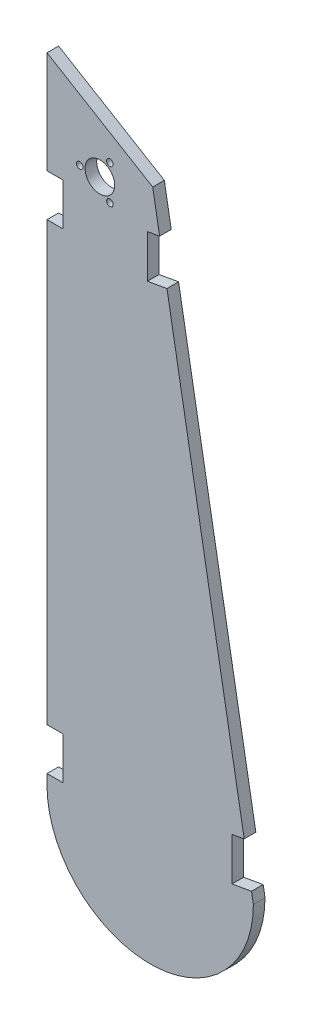
from build123d import *

# Parameters (mm, degrees)
EXTRUDE_1_DEPTH          = 5.5
SKETCH_5_R               = 7
CUT_EXTRUDE_1_DEPTH      = 316.527538037
SKETCH_6_R               = 1.55
CUT_EXTRUDE_2_DEPTH      = 316.527538037
PATTERN_CIRCULAR_1_COUNT = 3
SKETCH_7_W               = 7.5
SKETCH_7_H               = 20
CUT_EXTRUDE_3_DEPTH      = 316.527538037
SKETCH_8_W               = 7.5
SKETCH_8_H               = 20
CUT_EXTRUDE_4_DEPTH      = 316.6542844
CUT_EXTRUDE_5_DEPTH      = 316.6542844
CUT_EXTRUDE_6_DEPTH      = 316.6542844


with BuildPart() as part:
    # ｽｹｯﾁ1 → ﾎﾞｽ - 押し出し1 (new body)
    with BuildSketch(Plane.XY):
        with BuildLine():
            Line((0, 0), (0, 300))
            Line((0, 300), (50, 270))
            Line((50, 270), (97.608284791, 0))
            ThreePointArc((97.608284791, 0), (48.804142396, -48.804142396), (0, 0))
        make_face()
    extrude(amount=EXTRUDE_1_DEPTH)

    # ｽｹｯﾁ5 → ｶｯﾄ - 押し出し1 (cut, through all)
    with BuildSketch(Plane(origin=(0, 0, 0), x_dir=(-1, 0, 0), z_dir=(0, 0, -1))):
        with Locations((-25, 261.643590902)):
            Circle(SKETCH_5_R)
    extrude(amount=-CUT_EXTRUDE_1_DEPTH, mode=Mode.SUBTRACT)

    # ｽｹｯﾁ6 → ｶｯﾄ - 押し出し2 (cut, through all)
    with BuildSketch(Plane(origin=(0, 0, 0), x_dir=(-1, 0, 0), z_dir=(0, 0, -1))):
        with Locations((-15.5, 261.643590902)):
            Circle(SKETCH_6_R)
    cut_extrude_2 = extrude(amount=-CUT_EXTRUDE_2_DEPTH, mode=Mode.SUBTRACT)

    # 円形ﾊﾟﾀｰﾝ1: ｶｯﾄ - 押し出し2 ×3 about axis
    pattern_circular_1_axis = Axis((25, 261.643590902, 0), (0, 0, 1))
    for i in range(1, PATTERN_CIRCULAR_1_COUNT):
        add(cut_extrude_2.rotate(pattern_circular_1_axis, i * 360 / PATTERN_CIRCULAR_1_COUNT), mode=Mode.SUBTRACT)

    # ｽｹｯﾁ7 → ｶｯﾄ - 押し出し3 (cut, through all)
    with BuildSketch(Plane(origin=(0, 0, 0), x_dir=(-1, 0, 0), z_dir=(0, 0, -1))):
        with Locations((-3.75, 14.792318117)):
            Rectangle(SKETCH_7_W, SKETCH_7_H)
    extrude(amount=-CUT_EXTRUDE_3_DEPTH, mode=Mode.SUBTRACT)

    # ｽｹｯﾁ8 → ｶｯﾄ - 押し出し4 (cut, through all)
    with BuildSketch(Plane(origin=(0, 0, -5), x_dir=(-1, 0, 0), z_dir=(0, 0, -1))):
        with Locations((-3.75, 241.643590902)):
            Rectangle(SKETCH_8_W, SKETCH_8_H)
    extrude(amount=-CUT_EXTRUDE_4_DEPTH, mode=Mode.SUBTRACT)

    # ｽｹｯﾁ9 → ｶｯﾄ - 押し出し5 (cut, through all)
    with BuildSketch(Plane(origin=(0, 0, -5), x_dir=(-1, 0, 0), z_dir=(0, 0, -1))):
        Polygon((-96.736481777, 4.944240587), (-93.263518223, 24.640395647), (-87.5, 23.624131881), (-87.5, 3.315599643), align=None)
    extrude(amount=-CUT_EXTRUDE_5_DEPTH, mode=Mode.SUBTRACT)

    # ｽｹｯﾁ10 → ｶｯﾄ - 押し出し6 (cut, through all)
    with BuildSketch(Plane(origin=(0, 0, -5), x_dir=(-1, 0, 0), z_dir=(0, 0, -1))):
        Polygon((-53.263518223, 251.491668432), (-56.736481777, 231.795513372), (-47.5, 230.166872428), (-47.5, 250.475404665), align=None)
    extrude(amount=-CUT_EXTRUDE_6_DEPTH, mode=Mode.SUBTRACT)


solid = part.part
